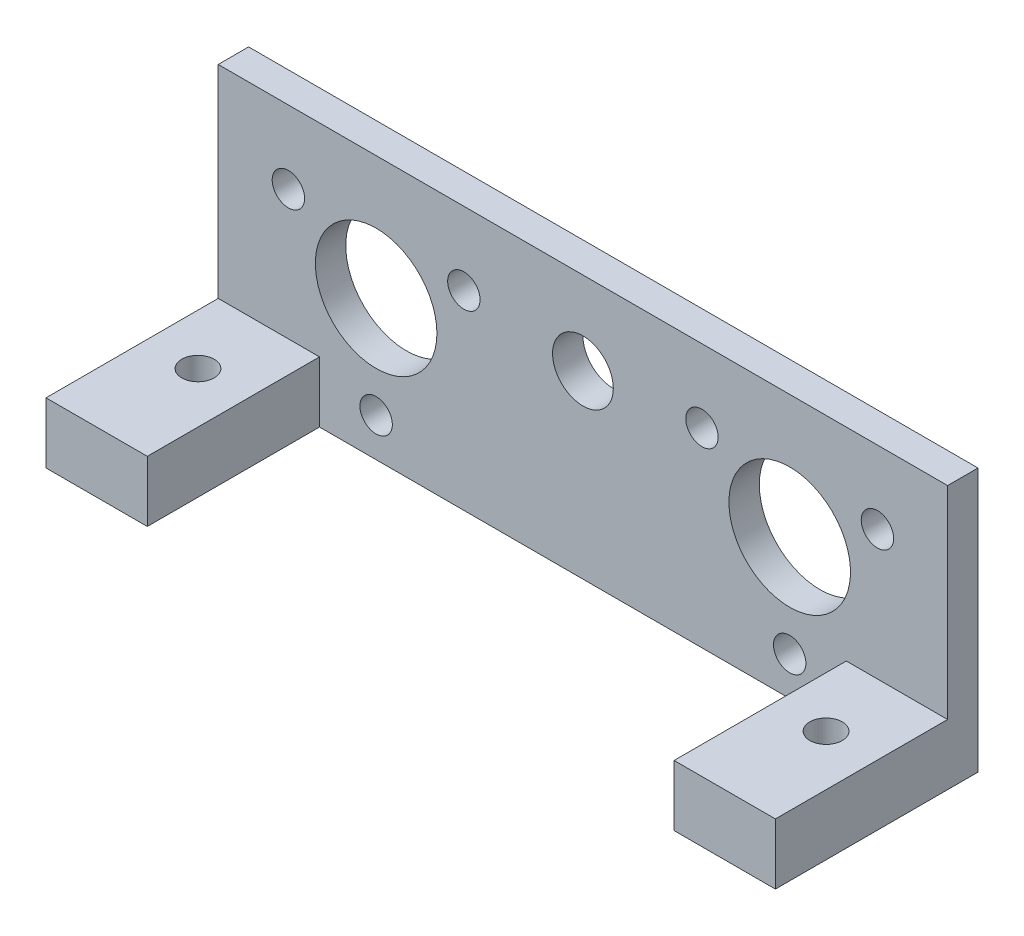
from build123d import *

# Parameters (mm, degrees)
SKETCH_1_W         = 35.99999999
SKETCH_1_H         = 13
SKETCH_1_R         = 2.999999999
SKETCH_1_R_2       = 0.8
SKETCH_1_R_3       = 1.500000001
SKETCH_1_R_4       = 0.799999999
SKETCH_1_R_5       = 0.799999997
SKETCH_1_R_6       = 0.799999998
SKETCH_1_R_7       = 2.999999997
EXTRUDE_1_DEPTH    = 1.5
SKETCH_2_W         = 5
SKETCH_2_H         = 3
SKETCH_2_W_2       = 4.999999998
EXTRUDE_2_DEPTH    = 8.5
HOLE_WIZARD_M2_1_D = 1.6


with BuildPart() as part:
    # 스케치1 → 돌출1 (new body)
    with BuildSketch(Plane.XY):
        with Locations((-1e-09, -2.4)):
            Rectangle(SKETCH_1_W, SKETCH_1_H)
        with Locations((-10.205880656, -2.000000001)):
            Circle(SKETCH_1_R, mode=Mode.SUBTRACT)
        with Locations((-14.536007677, 0.5)):
            Circle(SKETCH_1_R_2, mode=Mode.SUBTRACT)
        with Locations((-5.875753638, 0.499999998)):
            Circle(SKETCH_1_R_2, mode=Mode.SUBTRACT)
        with Locations((-1e-09, 0)):
            Circle(SKETCH_1_R_3, mode=Mode.SUBTRACT)
        with Locations((-10.205880656, -7.000000001)):
            Circle(SKETCH_1_R_4, mode=Mode.SUBTRACT)
        with Locations(Location((10.205880654, -7.000000001, 0), (0, 0, 180))):
            Circle(SKETCH_1_R_5, mode=Mode.SUBTRACT)
        with Locations(Location((5.875753636, 0.499999998, 0), (0, 0, 180))):
            Circle(SKETCH_1_R_5, mode=Mode.SUBTRACT)
        with Locations(Location((14.536007674, 0.5, 0), (0, 0, 180))):
            Circle(SKETCH_1_R_6, mode=Mode.SUBTRACT)
        with Locations(Location((10.205880654, -2.000000001, 0), (0, 0, 180))):
            Circle(SKETCH_1_R_7, mode=Mode.SUBTRACT)
    extrude(amount=EXTRUDE_1_DEPTH)

    # 스케치2 → 돌출2 (add)
    with BuildSketch(Plane.XY.offset(1.5)):
        with Locations((-15.499999996, -7.4)):
            Rectangle(SKETCH_2_W, SKETCH_2_H)
        with Locations((15.499999995, -7.4)):
            Rectangle(SKETCH_2_W_2, SKETCH_2_H)
    extrude(amount=EXTRUDE_2_DEPTH)

    # M2 탭을 위한 탭 드릴1 (through all)
    with Locations(Plane(origin=(-15.499999996, -8.9, 5), x_dir=(-1, 0, 0), z_dir=(0, -1, 0))):
        with Locations((0, 0), (-30.999999991, 0)):
            Hole(HOLE_WIZARD_M2_1_D / 2)


solid = part.part
